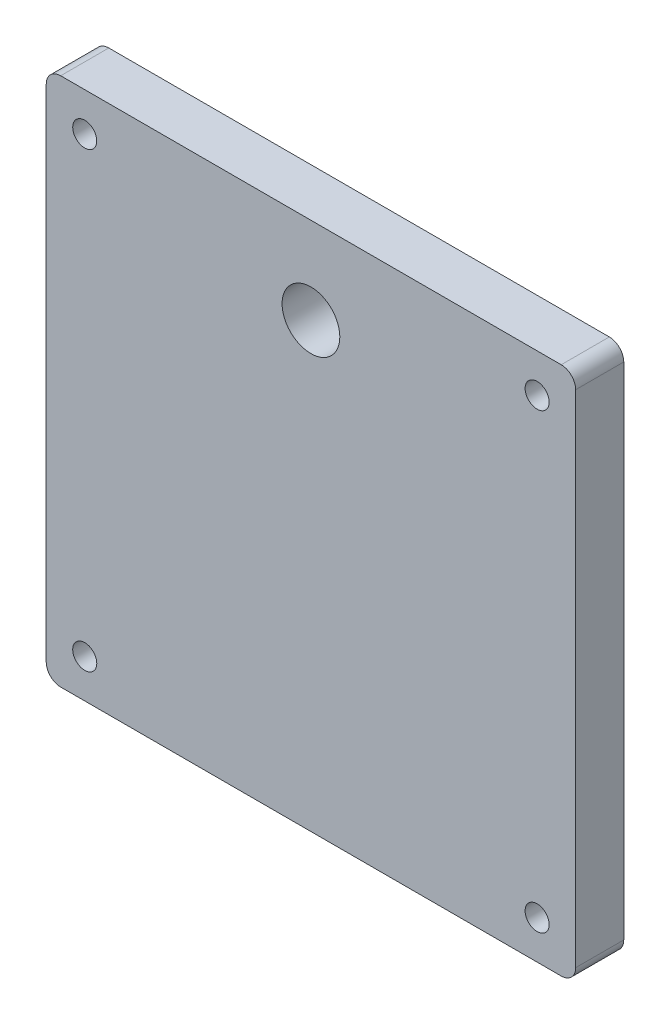
from build123d import *

# Parameters (mm, degrees)
SKETCH1_R           = 2.5
SKETCH1_R_2         = 6
BOSS_EXTRUDE1_DEPTH = 10


with BuildPart() as part:
    # Sketch1 → Boss-Extrude1 (new body)
    with BuildSketch(Plane.XY):
        with BuildLine():
            Line((-52, 55), (52, 55))
            ThreePointArc((52, 55), (54.121320344, 54.121320344), (55, 52))
            Line((55, 52), (55, -52))
            ThreePointArc((55, -52), (54.121320344, -54.121320344), (52, -55))
            Line((52, -55), (-52, -55))
            ThreePointArc((-52, -55), (-54.121320344, -54.121320344), (-55, -52))
            Line((-55, -52), (-55, 52))
            ThreePointArc((-55, 52), (-54.121320344, 54.121320344), (-52, 55))
        make_face()
        with Locations((47, 47)):
            Circle(SKETCH1_R, mode=Mode.SUBTRACT)
        with Locations(Location((47, -47, 0), (0, 0, 180))):
            Circle(SKETCH1_R, mode=Mode.SUBTRACT)
        with Locations((-47, -47)):
            Circle(SKETCH1_R, mode=Mode.SUBTRACT)
        with Locations(Location((-47, 47, 0), (0, 0, 180))):
            Circle(SKETCH1_R, mode=Mode.SUBTRACT)
        with Locations((0, 37)):
            Circle(SKETCH1_R_2, mode=Mode.SUBTRACT)
    extrude(amount=BOSS_EXTRUDE1_DEPTH)


solid = part.part
